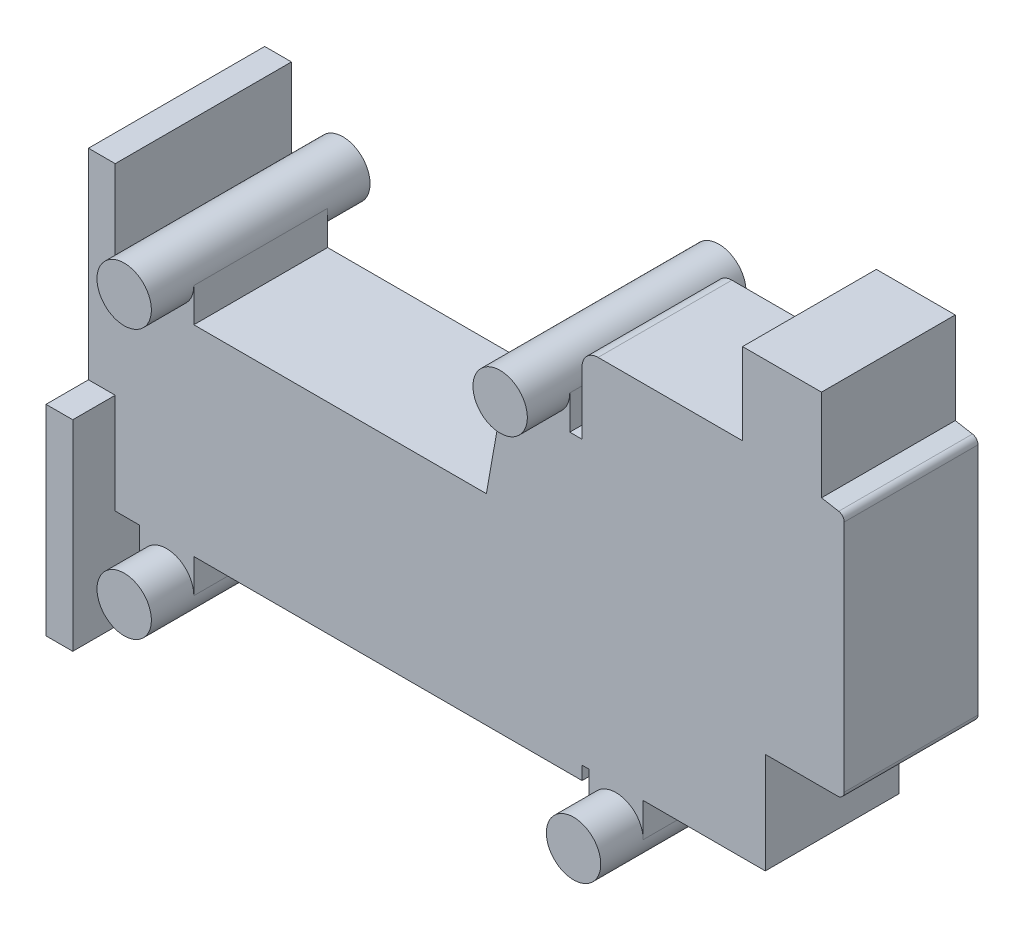
from build123d import *

# Parameters (mm, degrees)
SKETCH1_W                = 25.4
SKETCH1_H                = 15
BOSS_EXTRUDE1_DEPTH      = 10
BOSS_EXTRUDE2_DEPTH      = 10
SKETCH3_W                = 3.175
SKETCH3_H                = 14.99375
BOSS_EXTRUDE3_DEPTH      = 2
BOSS_EXTRUDE6_DEPTH      = 10
BOSS_EXTRUDE7_DEPTH      = 3.175
BOSS_EXTRUDE7_DEPTH_BACK = 13.175
SKETCH7_R                = 2.032


with BuildPart() as part:
    # Sketch1 → Boss-Extrude1 (new body)
    with BuildSketch(Plane.XY):
        Rectangle(SKETCH1_W, SKETCH1_H)
    extrude(amount=BOSS_EXTRUDE1_DEPTH)

    # Sketch2 → Boss-Extrude2 (add)
    with BuildSketch(Plane.XY.offset(10)):
        with BuildLine():
            Line((40.1, 19.759426681), (40.970013246, 19.606019872))
            Line((40.970013246, 19.606019872), (41.386824089, 19.532524875))
            ThreePointArc((41.386824089, 19.532524875), (41.683022222, 19.361514803), (41.8, 19.040120998))
            Line((41.8, 19.040120998), (41.8, 1.55))
            ThreePointArc((41.8, 1.55), (41.653553391, 1.196446609), (41.3, 1.05))
            Line((41.3, 1.05), (40.883189158, 1.05))
            Line((40.883189158, 1.05), (35.9, 1.05))
            Line((35.9, 1.05), (35.9, -2.35))
            Line((35.9, -2.35), (35.9, -6.5))
            Line((35.9, -6.5), (34.9, -6.5))
            Line((34.9, -6.5), (22.2, -6.5))
            Line((22.2, -6.5), (22.2, -7.5))
            Line((22.2, -7.5), (9.4, -7.5))
            Line((9.4, -7.5), (9.4, 7.5))
            Line((9.4, 7.5), (15.048, 7.5))
            Line((15.048, 7.5), (16.3, 14.6))
            Line((16.3, 14.6), (22.2, 14.6))
            Line((22.2, 14.6), (22.2, 19.3))
            ThreePointArc((22.2, 19.3), (22.551471863, 20.148528137), (23.4, 20.5))
            Line((23.4, 20.5), (34.2, 20.5))
            Line((34.2, 20.5), (34.2, 26.6))
            Line((34.2, 26.6), (40.1, 26.6))
            Line((40.1, 26.6), (40.1, 19.759426681))
        make_face()
        Polygon((-14.7, 14.2), (-14.7, 14.99375), (-12.7, 14.99375), (-12.7, 14.2), (-12.7, 12.710514427), (-12.7, 7.5), (-12.7, 0), (-12.7, -10.069090909), (-12.7, -14.2), (-12.7, -14.99375), (-14.7, -14.99375), (-14.7, -14.2), (-14.7, -10.069090909), (-14.7, 0), (-14.7, 7.5), (-14.7, 11), align=None)
    extrude(amount=-BOSS_EXTRUDE2_DEPTH)

    # Sketch3 → Boss-Extrude3 (add)
    with BuildSketch(Plane.ZY.offset(14.7)):
        with Locations((-1.5875, 7.496875)):
            Rectangle(SKETCH3_W, SKETCH3_H)
        with Locations((11.5875, -7.496875)):
            Rectangle(SKETCH3_W, SKETCH3_H)
    extrude(amount=-BOSS_EXTRUDE3_DEPTH)

    # Sketch6 → Boss-Extrude6 (add)
    with BuildSketch(Plane.XY.offset(10)):
        with BuildLine():
            Line((-10.887, 7.5), (-10.887, 10.04))
            ThreePointArc((-10.887, 10.04), (-8.855, 12.072), (-6.823, 10.04))
            Line((-6.823, 10.04), (-6.823, 7.5))
            ThreePointArc((-6.823, 7.5), (-8.855, 5.468), (-10.887, 7.5))
        make_face()
        with BuildLine():
            Line((-10.887, -7.5), (-10.887, -10.04))
            ThreePointArc((-10.887, -10.04), (-8.855, -12.072), (-6.823, -10.04))
            Line((-6.823, -10.04), (-6.823, -7.5))
            ThreePointArc((-6.823, -7.5), (-8.855, -5.468), (-10.887, -7.5))
        make_face()
        with BuildLine():
            Line((17.218, 14.6), (17.218, 17.14))
            ThreePointArc((17.218, 17.14), (19.25, 19.172), (21.282, 17.14))
            Line((21.282, 17.14), (21.282, 14.6))
            ThreePointArc((21.282, 14.6), (19.25, 12.568), (17.218, 14.6))
        make_face()
        with BuildLine():
            Line((26.772, -6.5), (26.772, -9.04))
            ThreePointArc((26.772, -9.04), (24.74, -11.072), (22.708, -9.04))
            Line((22.708, -9.04), (22.708, -6.5))
            ThreePointArc((22.708, -6.5), (24.74, -4.468), (26.772, -6.5))
        make_face()
    extrude(amount=-BOSS_EXTRUDE6_DEPTH)

    # Sketch7 → Boss-Extrude7 (add, two sides: drawn at the far end of the back side and taken through both)
    with BuildSketch(Plane(origin=(0, 0, 0), x_dir=(-1, 0, 0), z_dir=(0, 0, -1)).offset(-BOSS_EXTRUDE7_DEPTH_BACK)):
        with Locations((-19.25, 17.14)):
            Circle(SKETCH7_R)
        with Locations((-24.74, -9.04)):
            Circle(SKETCH7_R)
        with Locations((8.855, -10.04)):
            Circle(SKETCH7_R)
        with Locations((8.855, 10.04)):
            Circle(SKETCH7_R)
    extrude(amount=BOSS_EXTRUDE7_DEPTH + BOSS_EXTRUDE7_DEPTH_BACK)


solid = part.part
